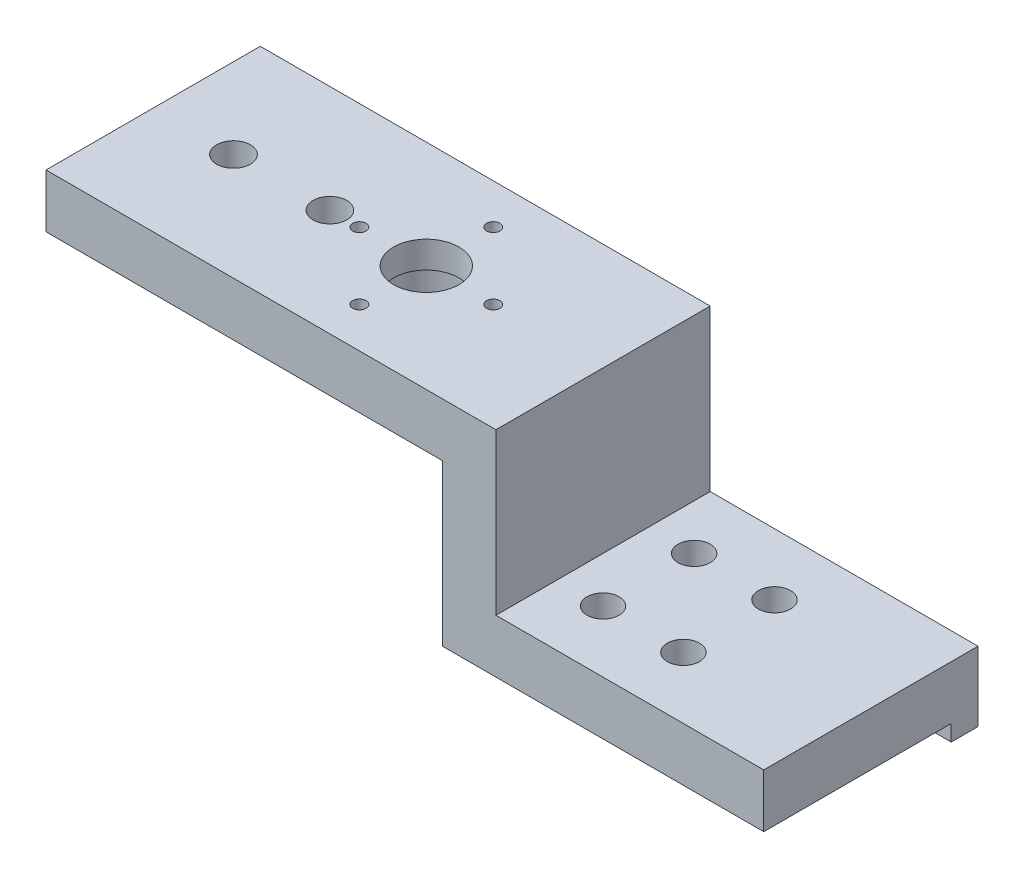
from build123d import *

# Parameters (mm, degrees)
SKETCH1_W           = 60
SKETCH1_H           = 40
BOSS_EXTRUDE1_DEPTH = 10
SKETCH2_W           = 10
SKETCH2_H           = 40
BOSS_EXTRUDE2_DEPTH = 30
SKETCH3_W           = 40
SKETCH3_H           = 10
BOSS_EXTRUDE3_DEPTH = 74
SKETCH4_R           = 6.1
SKETCH4_R_2         = 3.15
CUT_EXTRUDE1_DEPTH  = 74
SKETCH5_R           = 3
CUT_EXTRUDE2_DEPTH  = 74
SKETCH6_R           = 3.5
CUT_EXTRUDE3_DEPTH  = 3
SKETCH7_R           = 6.5
CUT_EXTRUDE4_DEPTH  = 5
M3_TAPPED_HOLE1_D   = 2.5
CIRPATTERN1_COUNT   = 4
SKETCH10_W          = 60
SKETCH10_H          = 5
BOSS_EXTRUDE4_DEPTH = 3


with BuildPart() as part:
    # Sketch1 → Boss-Extrude1 (new body)
    with BuildSketch(Plane(origin=(0, 0, 0), x_dir=(1, 0, 0), z_dir=(0, 1, 0))):
        Rectangle(SKETCH1_W, SKETCH1_H)
    extrude(amount=BOSS_EXTRUDE1_DEPTH)

    # Sketch2 → Boss-Extrude2 (add)
    with BuildSketch(Plane(origin=(0, 10, 0), x_dir=(1, 0, 0), z_dir=(0, 1, 0))):
        with Locations((-25, 0)):
            Rectangle(SKETCH2_W, SKETCH2_H)
    extrude(amount=BOSS_EXTRUDE2_DEPTH)

    # Sketch3 → Boss-Extrude3 (add)
    with BuildSketch(Plane.ZY.offset(30)):
        with Locations((0, 35)):
            Rectangle(SKETCH3_W, SKETCH3_H)
    extrude(amount=BOSS_EXTRUDE3_DEPTH)

    # Sketch4 → Cut-Extrude1 (cut)
    with BuildSketch(Plane.XZ.offset(-30)):
        with Locations(Location((-53, 0, 0), (0, 0, 270))):
            Circle(SKETCH4_R)
        with Locations(Location((-71, 0, 0), (0, 0, 270))):
            Circle(SKETCH4_R_2)
        with Locations(Location((-89, 0, 0), (0, 0, 270))):
            Circle(SKETCH4_R_2)
    extrude(amount=-CUT_EXTRUDE1_DEPTH, mode=Mode.SUBTRACT)

    # Sketch5 → Cut-Extrude2 (cut)
    with BuildSketch(Plane.XZ):
        with Locations(Location((-11.5, 8.5, 0), (0, 0, 270))):
            Circle(SKETCH5_R)
        with Locations(Location((-11.5, -8.5, 0), (0, 0, 270))):
            Circle(SKETCH5_R)
        with Locations(Location((3.5, 8.5, 0), (0, 0, 270))):
            Circle(SKETCH5_R)
        with Locations(Location((3.5, -8.5, 0), (0, 0, 270))):
            Circle(SKETCH5_R)
    extrude(amount=-CUT_EXTRUDE2_DEPTH, mode=Mode.SUBTRACT)

    # Sketch6 → Cut-Extrude3 (cut)
    with BuildSketch(Plane.XZ.offset(-30)):
        with Locations(Location((-89, 0, 0), (0, 0, 270))):
            Circle(SKETCH6_R)
        with Locations(Location((-71, 0, 0), (0, 0, 270))):
            Circle(SKETCH6_R)
    extrude(amount=-CUT_EXTRUDE3_DEPTH, mode=Mode.SUBTRACT)

    # Sketch7 → Cut-Extrude4 (cut)
    with BuildSketch(Plane.XZ.offset(-30)):
        with Locations(Location((-53, 0, 0), (0, 0, 270))):
            Circle(SKETCH7_R)
    extrude(amount=-CUT_EXTRUDE4_DEPTH, mode=Mode.SUBTRACT)

    # M3 Tapped Hole1 (through all)
    with Locations(Plane(origin=(0, 40, 0), x_dir=(1, 0, 0), z_dir=(0, 1, 0))):
        with Locations((-53, 12.5)):
            m3_tapped_hole1 = Hole(M3_TAPPED_HOLE1_D / 2)

    # CirPattern1: M3 Tapped Hole1 ×4 about axis
    cirpattern1_axis = Axis((-53, 0, 0), (0, 1, 0))
    for i in range(1, CIRPATTERN1_COUNT):
        add(m3_tapped_hole1.rotate(cirpattern1_axis, i * 360 / CIRPATTERN1_COUNT), mode=Mode.SUBTRACT)

    # Sketch10 → Boss-Extrude4 (add)
    with BuildSketch(Plane.XZ):
        with Locations((0, -17.5)):
            Rectangle(SKETCH10_W, SKETCH10_H)
    extrude(amount=BOSS_EXTRUDE4_DEPTH)


solid = part.part
